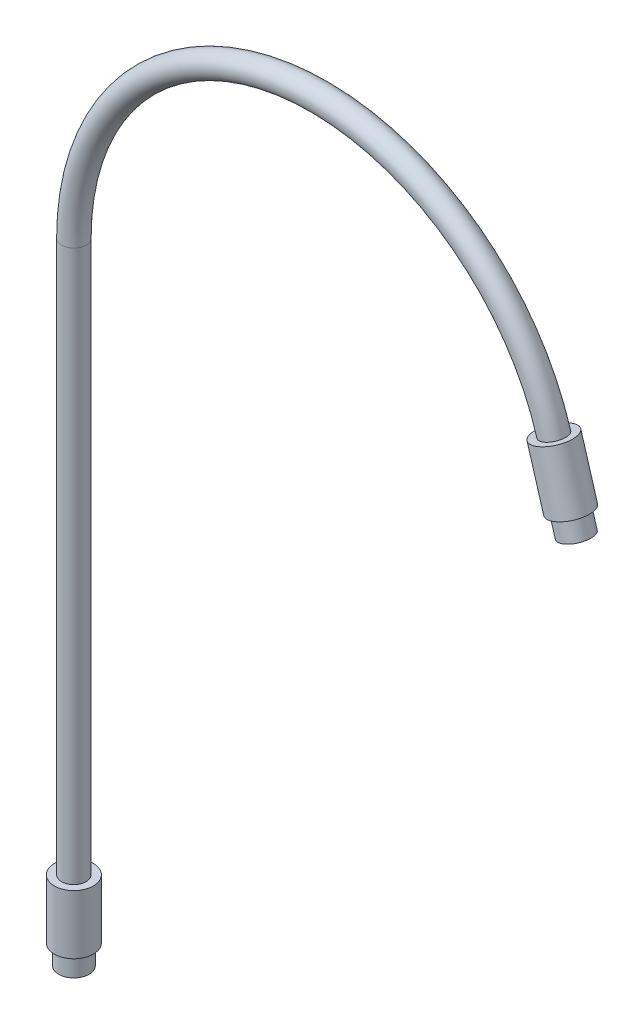
from build123d import *

# Parameters (mm, degrees)
SWEEP3_PROFILE_R    = 3.1
SKETCH17_R          = 4.95
BOSS_EXTRUDE1_DEPTH = 15
SKETCH18_R          = 3.85
BOSS_EXTRUDE2_DEPTH = 5
SKETCH19_R          = 4.95
BOSS_EXTRUDE3_DEPTH = 15
SKETCH20_R          = 3.85
BOSS_EXTRUDE4_DEPTH = 5


with BuildPart() as part:
    # Sweep3: sweep along a path in Sketch9
    with BuildLine(Plane.XY) as sweep3_path:
        Line((-183.399133976, 40), (-183.399133976, 180))
        ThreePointArc((-183.399133976, 180), (-130.108654619, 241.593132461), (-61.492979679, 197.712860026))
    # Sweep3 profile (on start of the path) → Sweep3 (sweep)
    with BuildSketch(Plane(origin=(-183.399133976, 40, 0), x_dir=(0, 0, 1), z_dir=(0, 1, 0))):
        Circle(SWEEP3_PROFILE_R)
    sweep(path=sweep3_path.line)

    # Sketch17 → Boss-Extrude1 (add)
    with BuildSketch(Plane.XZ.offset(-40)):
        with Locations((-183.399133976, 0)):
            Circle(SKETCH17_R)
    extrude(amount=BOSS_EXTRUDE1_DEPTH)

    # Sketch18 → Boss-Extrude2 (add)
    with BuildSketch(Plane.XZ.offset(-25)):
        with Locations((-183.399133976, 0)):
            Circle(SKETCH18_R)
    extrude(amount=BOSS_EXTRUDE2_DEPTH)

    # Sketch19 → Boss-Extrude3 (add)
    with BuildSketch(Plane(origin=(-58.920841531, 198.476439545, 0), x_dir=(0.9586493060523679, 0.28459007011017384, 0), z_dir=(0.2845900701101738, -0.9586493060523678, 0))):
        with Locations(Location((-2.6830856, 0, 0), (0, 0, 180))):
            Circle(SKETCH19_R)
    extrude(amount=BOSS_EXTRUDE3_DEPTH)

    # Sketch20 → Boss-Extrude4 (add)
    with BuildSketch(Plane(origin=(-54.651990479, 184.096699954, 0), x_dir=(0.9586493060523679, 0.2845900701101739, 0), z_dir=(0.28459007011017384, -0.9586493060523678, 0))):
        with Locations(Location((-2.6830856, 0, 0), (0, 0, 180))):
            Circle(SKETCH20_R)
    extrude(amount=BOSS_EXTRUDE4_DEPTH)


solid = part.part
